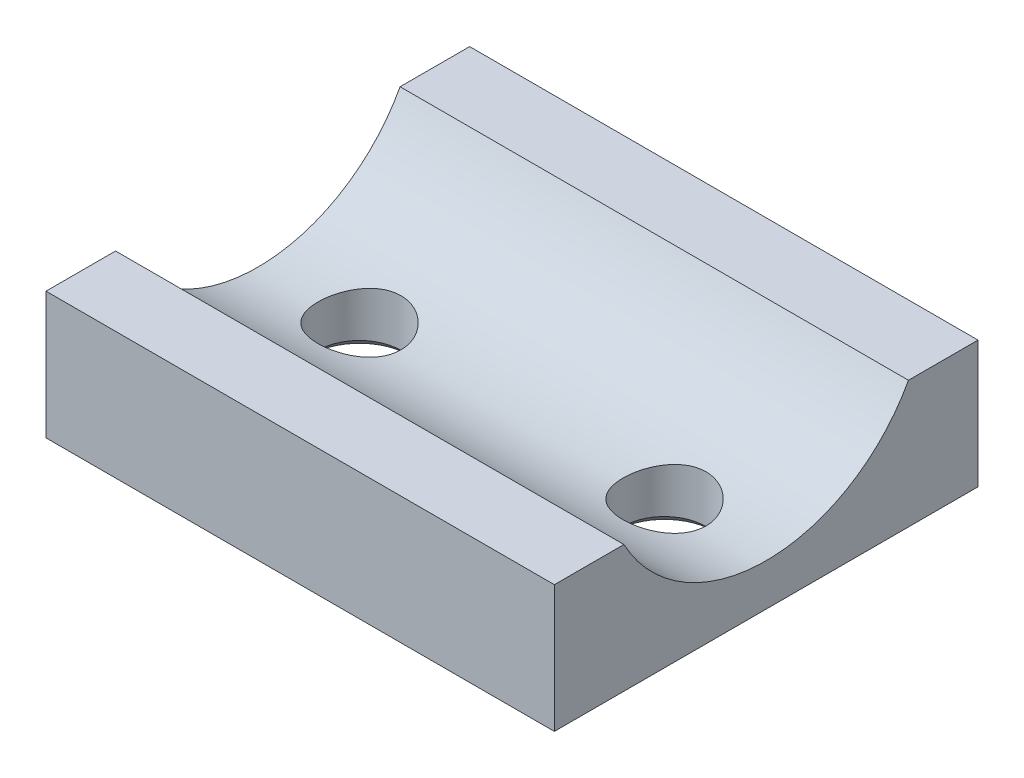
from build123d import *

# Parameters (mm, degrees)
BOSS_EXTRUDE1_DEPTH     = 15
CUT_EXTRUDE1_DEPTH      = 22.100947846
CUT_EXTRUDE1_DEPTH_BACK = 22.100947846
SKETCH2_R               = 2.45
CHAMFER1_SIZE           = 0.5


with BuildPart() as part:
    # Sketch1 → Boss-Extrude1 (new, symmetric)
    with BuildSketch(Plane(origin=(0, 0, 0), x_dir=(0, 0, -1), z_dir=(1, 0, 0))):
        with BuildLine():
            Line((-8.394976176, -4.5), (-12.5, -4.5))
            Line((-12.5, -4.5), (-12.5, -12.5))
            Line((-12.5, -12.5), (12.5, -12.5))
            Line((12.5, -12.5), (12.5, -4.5))
            Line((12.5, -4.5), (8.394976176, -4.5))
            ThreePointArc((8.394976176, -4.5), (0, -9.525), (-8.394976176, -4.5))
        make_face()
    extrude(amount=BOSS_EXTRUDE1_DEPTH, both=True)

    # Sketch2 → Cut-Extrude1 (cut, two sides: drawn at the far end of the back side and taken through both)
    with BuildSketch(Plane.XZ.offset(12.5).offset(-CUT_EXTRUDE1_DEPTH_BACK)):
        with Locations(Location((9, 0, 0), (0, 0, 270))):
            Circle(SKETCH2_R)
        with Locations(Location((-9, 0, 0), (0, 0, 270))):
            Circle(SKETCH2_R)
    extrude(amount=CUT_EXTRUDE1_DEPTH + CUT_EXTRUDE1_DEPTH_BACK, mode=Mode.SUBTRACT)

    # Chamfer1
    chamfer1_edges = [part.edges().sort_by_distance(p)[0] for p in [
        (0, -12.5, -12.5),
        (0, -12.5, 12.5),
        (15, -12.5, 0),
        (-9, -12.5, 2.45),
        (9, -12.5, 2.45),
        (-15, -12.5, 0),
    ]]
    chamfer(chamfer1_edges, length=CHAMFER1_SIZE)


solid = part.part
